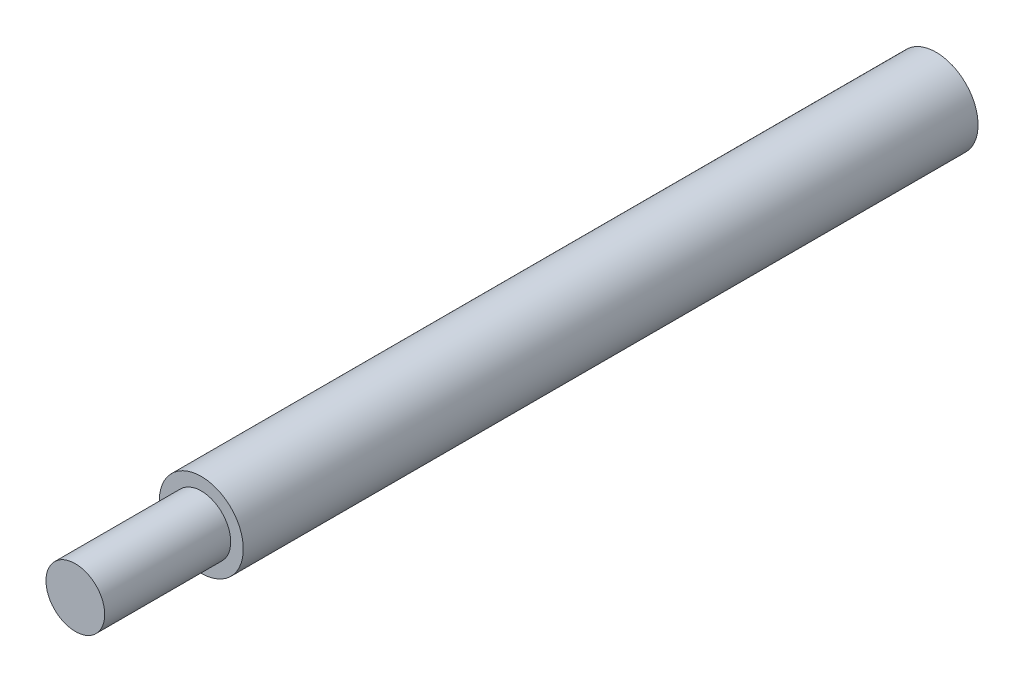
from build123d import *

# Parameters (mm, degrees)
SKETCH1_R           = 1.4
BOSS_EXTRUDE1_DEPTH = 6
SKETCH2_R           = 2
BOSS_EXTRUDE2_DEPTH = 35
SKETCH3_R           = 1.4
CUT_EXTRUDE1_DEPTH  = 10


with BuildPart() as part:
    # Sketch1 → Boss-Extrude1 (new body)
    with BuildSketch(Plane.XY):
        Circle(SKETCH1_R)
    extrude(amount=BOSS_EXTRUDE1_DEPTH)

    # Sketch2 → Boss-Extrude2 (add)
    with BuildSketch(Plane(origin=(0, 0, 0), x_dir=(-1, 0, 0), z_dir=(0, 0, -1))):
        Circle(SKETCH2_R)
    extrude(amount=BOSS_EXTRUDE2_DEPTH)

    # Sketch3 → Cut-Extrude1 (cut)
    with BuildSketch(Plane(origin=(0, 0, -35), x_dir=(-1, 0, 0), z_dir=(0, 0, -1))):
        with Locations(Location((0, 0, 0), (0, 0, 180))):
            Circle(SKETCH3_R)
    extrude(amount=-CUT_EXTRUDE1_DEPTH, mode=Mode.SUBTRACT)


solid = part.part
